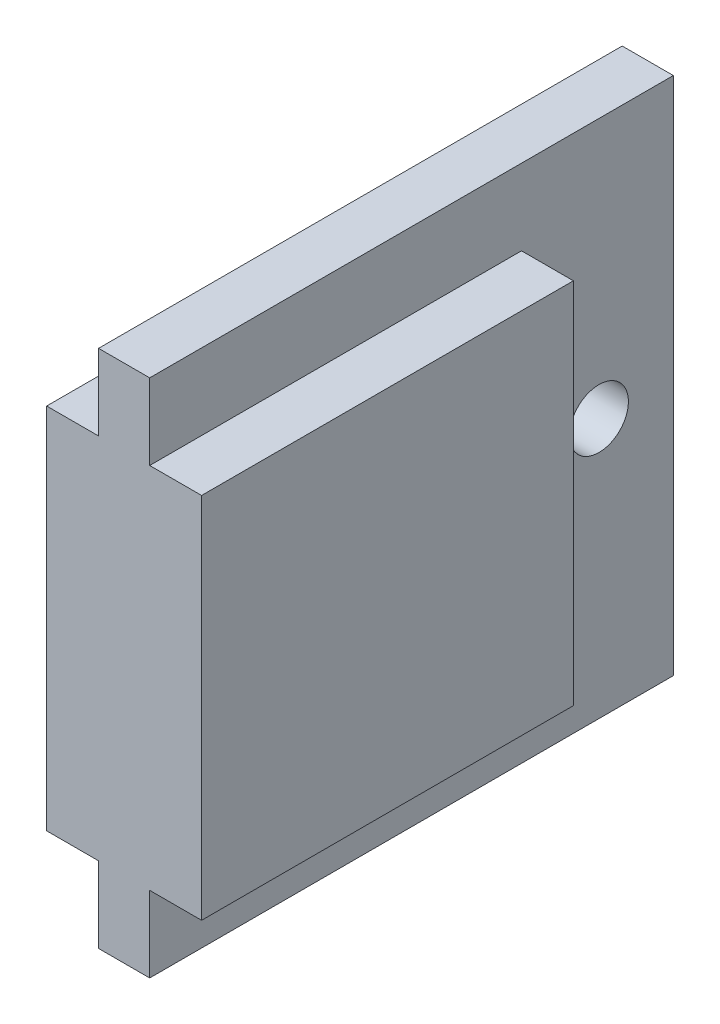
from build123d import *

# Parameters (mm, degrees)
SKETCH1_W           = 23.75
SKETCH1_H           = 24
BOSS_EXTRUDE1_DEPTH = 10
SKETCH2_W           = 3.3
SKETCH2_H           = 9.8
BOSS_EXTRUDE2_DEPTH = 23.75
SKETCH3_W           = 3.3
SKETCH3_H           = 33.8
BOSS_EXTRUDE3_DEPTH = 4.9
CUT_EXTRUDE1_REACH  = 36.413
SKETCH4_R           = 1.9


with BuildPart() as part:
    # Sketch1 → Boss-Extrude1 (new body)
    with BuildSketch(Plane.YZ):
        with Locations((11.875, 12)):
            Rectangle(SKETCH1_W, SKETCH1_H)
    extrude(amount=-BOSS_EXTRUDE1_DEPTH)

    # Sketch2 → Boss-Extrude2 (add, through all)
    with BuildSketch(Plane.XZ):
        with Locations((-5, -4.9)):
            Rectangle(SKETCH2_W, SKETCH2_H)
    extrude(amount=-BOSS_EXTRUDE2_DEPTH)

    # Sketch3 → Boss-Extrude3 (add)
    with BuildSketch(Plane.XZ):
        with Locations((-5, 7.1)):
            Rectangle(SKETCH3_W, SKETCH3_H)
    boss_extrude3 = extrude(amount=BOSS_EXTRUDE3_DEPTH)

    # Sketch4 → Cut-Extrude1 (cut, up to next)
    with BuildSketch(Plane(origin=(-6.65, 0, 0), x_dir=(0, -1, 0), z_dir=(-1, 0, 0)), mode=Mode.PRIVATE) as cut_extrude1_sk1:
        with Locations(Location((-11.875, -5, 0), (0, 0, 90))):
            Circle(SKETCH4_R)
    cut_extrude1_tool1 = extrude(cut_extrude1_sk1.sketch, amount=-CUT_EXTRUDE1_REACH, mode=Mode.PRIVATE) & part.part
    add(cut_extrude1_tool1.solids().sort_by_distance((-6.65, 11.875, -5))[0], mode=Mode.SUBTRACT)

    # Mirror1: Boss-Extrude3 across plane
    add(boss_extrude3.mirror(Plane(origin=(0, 11.875, 0), x_dir=(0, 0, 1), z_dir=(0, -1, 0))))


solid = part.part
